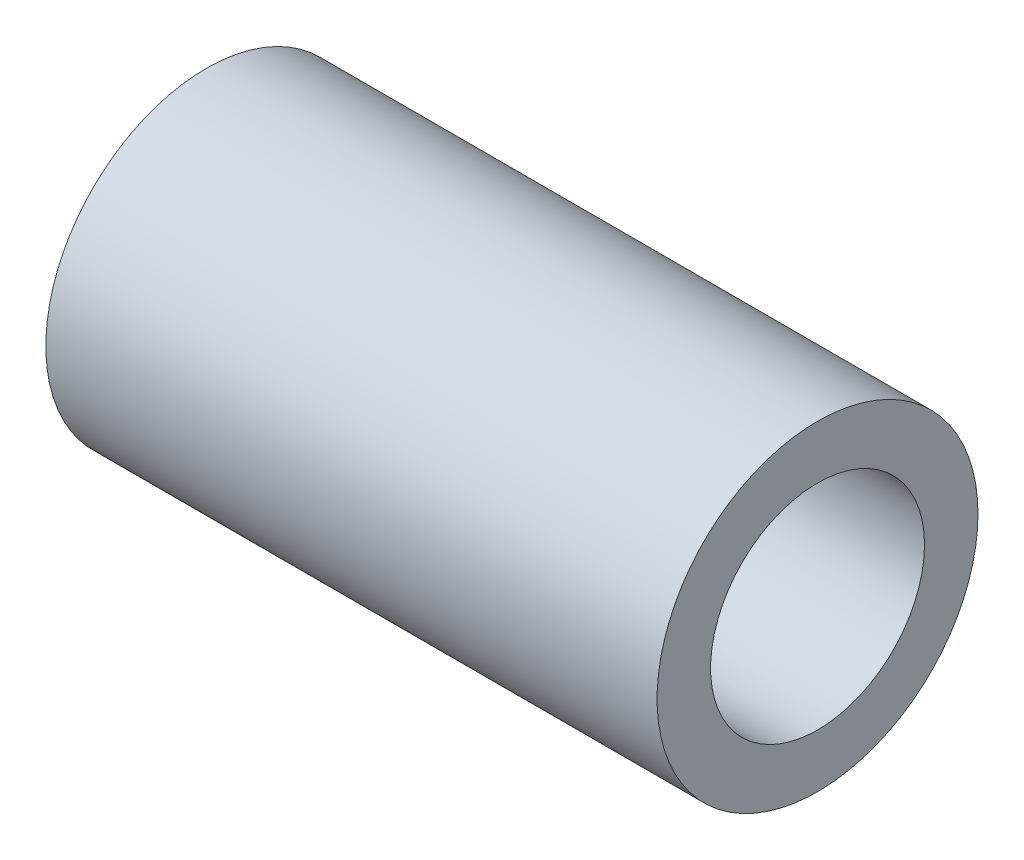
from build123d import *

# Parameters (mm, degrees)
SKETCH1_R           = 1.575
SKETCH1_R_2         = 1.05
BOSS_EXTRUDE1_DEPTH = 6


with BuildPart() as part:
    # Sketch1 → Boss-Extrude1 (new body)
    with BuildSketch(Plane(origin=(0, 0, 0), x_dir=(0, 0, -1), z_dir=(1, 0, 0))):
        Circle(SKETCH1_R)
        Circle(SKETCH1_R_2, mode=Mode.SUBTRACT)
    extrude(amount=BOSS_EXTRUDE1_DEPTH)


solid = part.part
